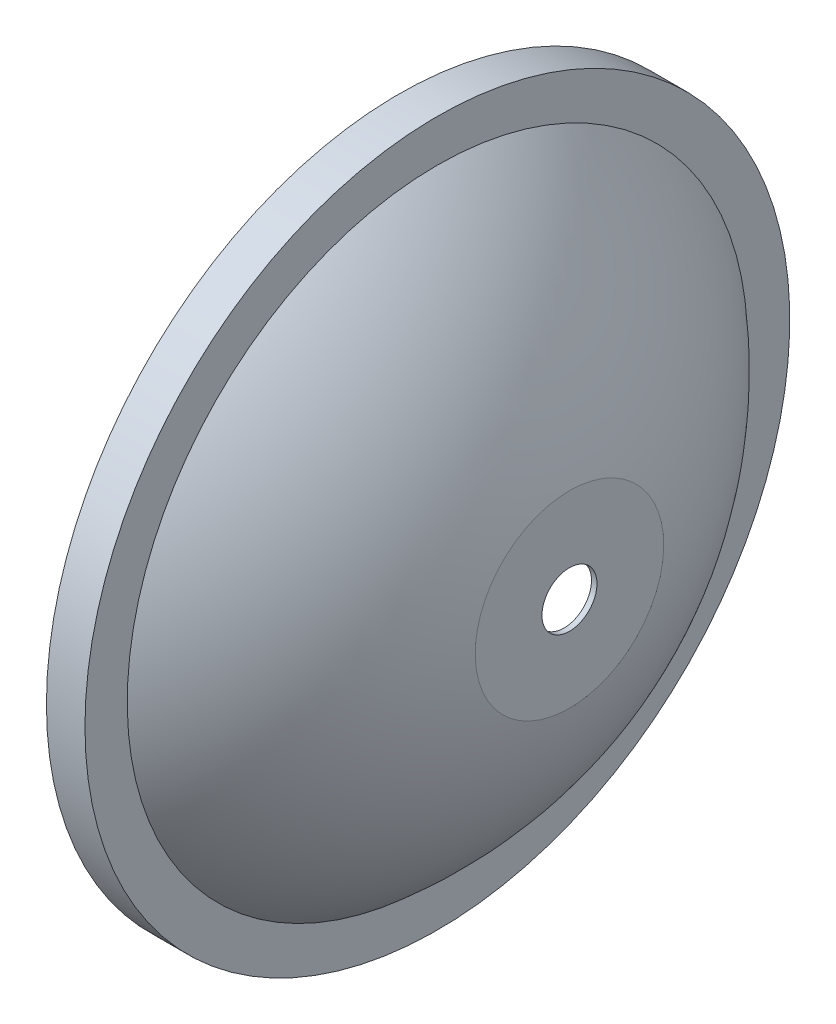
from build123d import *


with BuildPart() as part:
    # Sketch1 → Revolve1 (revolve)
    with BuildSketch(Plane.XY, mode=Mode.PRIVATE) as revolve1_sk:
        with BuildLine():
            Line((-29.992957397, 63), (-23.992957397, 63))
            Line((-23.992957397, 63), (-23.992957397, 55.856960175))
            ThreePointArc((-23.992957397, 55.856960175), (-8.879751576, 38.352961589), (0, 17))
            Line((0, 17), (0, 5))
            Line((0, 5), (1, 5))
            Line((1, 5), (1, 17.117654197))
            ThreePointArc((1, 17.117654197), (-7.875658194, 38.629089315), (-22.992957397, 56.320511361))
            Line((-22.992957397, 56.320511361), (-22.992957397, 64))
            Line((-22.992957397, 64), (-29.992957397, 64))
            Line((-29.992957397, 64), (-29.992957397, 63))
        make_face()
    revolve(revolve1_sk.sketch.rotate(Axis((0, 0, 0), (1, 0, 0)), 90), axis=Axis((0, 0, 0), (1, 0, 0)))


solid = part.part
